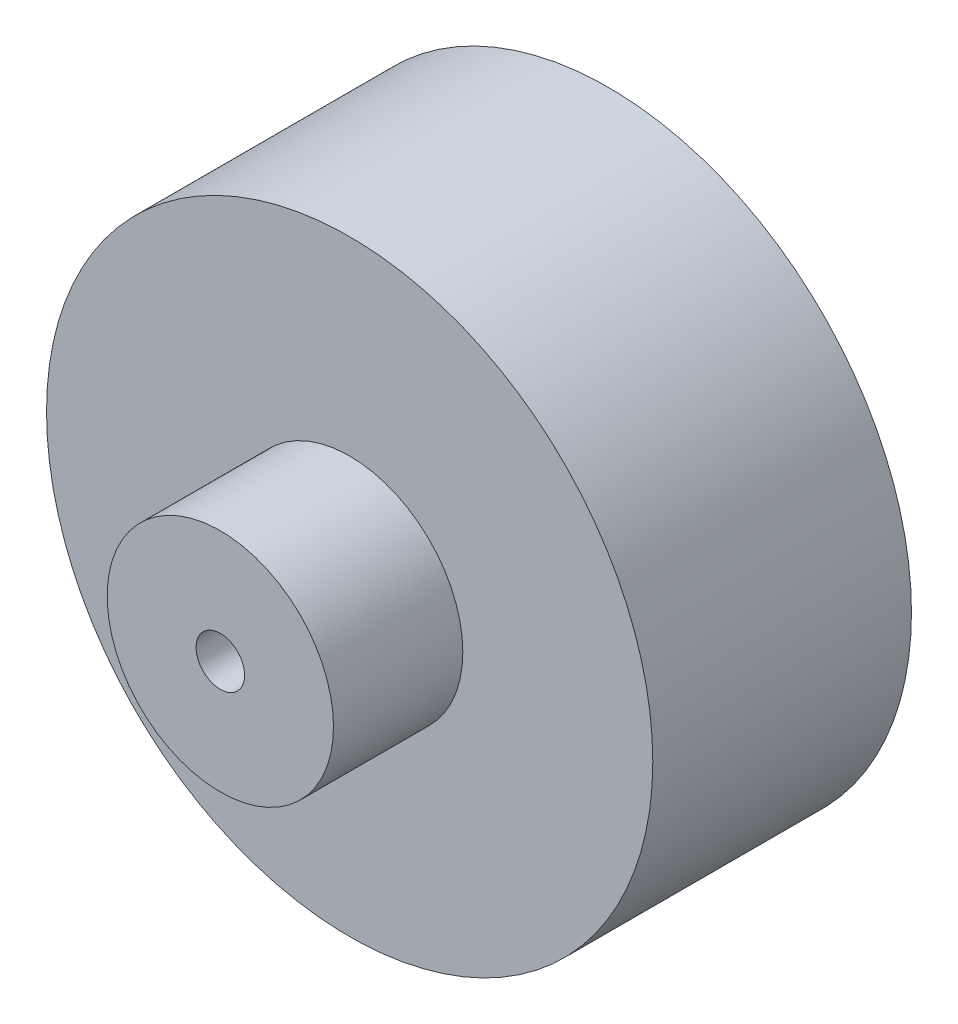
from build123d import *

# Parameters (mm, degrees)
SKETCH1_R           = 37.5
BOSS_EXTRUDE1_DEPTH = 32
SKETCH2_R           = 14
SKETCH2_R_2         = 3
BOSS_EXTRUDE2_DEPTH = 16


with BuildPart() as part:
    # Sketch1 → Boss-Extrude1 (new body)
    with BuildSketch(Plane.XY):
        Circle(SKETCH1_R)
    extrude(amount=BOSS_EXTRUDE1_DEPTH)

    # Sketch2 → Boss-Extrude2 (add)
    with BuildSketch(Plane.XY.offset(32)):
        Circle(SKETCH2_R)
        Circle(SKETCH2_R_2, mode=Mode.SUBTRACT)
    extrude(amount=BOSS_EXTRUDE2_DEPTH)


solid = part.part
